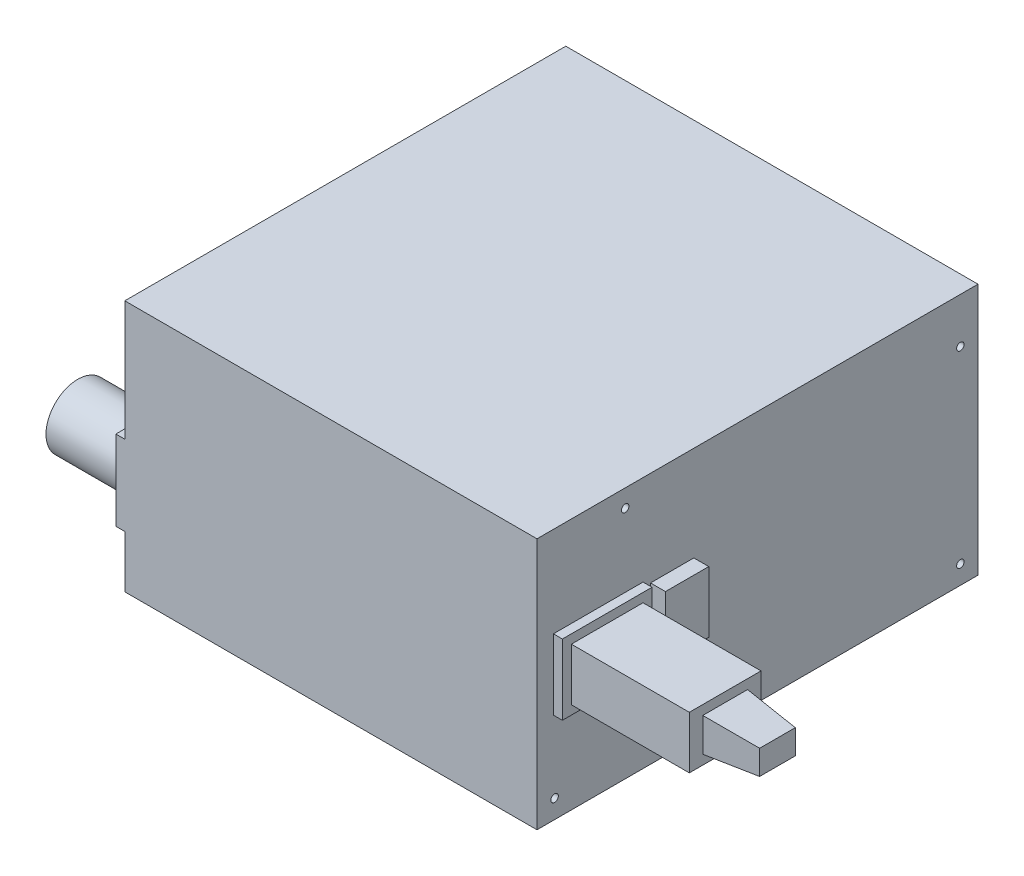
from build123d import *

# Parameters (mm, degrees)
SKETCH1_W           = 140.208
SKETCH1_H           = 150
BOSS_EXTRUDE1_DEPTH = 85.725
SKETCH2_W           = 30.48
SKETCH2_H           = 23.9522
SKETCH2_W_2         = 24.384
SKETCH2_H_2         = 17.8562
BOSS_EXTRUDE2_DEPTH = 3.048
SKETCH3_W           = 14.732
SKETCH3_H           = 20.828
BOSS_EXTRUDE3_DEPTH = 5.08
SKETCH4_R           = 1.27
CUT_EXTRUDE1_DEPTH  = 3.81
BOSS_EXTRUDE4_DEPTH = 3.048
SKETCH6_R           = 10.795
BOSS_EXTRUDE5_DEPTH = 25.4
SKETCH7_W           = 24.384
SKETCH7_H           = 17.8562
BOSS_EXTRUDE6_DEPTH = 43.18
SKETCH8_W           = 15.24
SKETCH8_H           = 11.43
BOSS_EXTRUDE7_DEPTH = 17.78
BOSS_EXTRUDE7_TAPER = 5


with BuildPart() as part:
    # Sketch1 → Boss-Extrude1 (new body)
    with BuildSketch(Plane(origin=(0, 0, 0), x_dir=(1, 0, 0), z_dir=(0, 1, 0))):
        with Locations((-120.400582929, 25.928824242)):
            Rectangle(SKETCH1_W, SKETCH1_H)
    extrude(amount=BOSS_EXTRUDE1_DEPTH)

    # Sketch2 → Boss-Extrude2 (add)
    with BuildSketch(Plane(origin=(-50.296582929, 0, 0), x_dir=(0, 0, -1), z_dir=(1, 0, 0))):
        with Locations((-28.243175758, 42.9641)):
            Rectangle(SKETCH2_W, SKETCH2_H)
        with Locations((-28.243175758, 42.9641)):
            Rectangle(SKETCH2_W_2, SKETCH2_H_2, mode=Mode.SUBTRACT)
    extrude(amount=BOSS_EXTRUDE2_DEPTH)

    # Sketch3 → Boss-Extrude3 (add)
    with BuildSketch(Plane(origin=(-50.296582929, 0, 0), x_dir=(0, 0, -1), z_dir=(1, 0, 0))):
        with Locations((-3.097175758, 43.0022)):
            Rectangle(SKETCH3_W, SKETCH3_H)
    extrude(amount=BOSS_EXTRUDE3_DEPTH)

    # Sketch4 → Cut-Extrude1 (cut)
    with BuildSketch(Plane(origin=(-50.296582929, 0, 0), x_dir=(0, 0, -1), z_dir=(1, 0, 0))):
        with Locations((-43.071175758, 6.35)):
            Circle(SKETCH4_R)
        with Locations((94.928824242, 6.35)):
            Circle(SKETCH4_R)
        with Locations((94.928824242, 70.35)):
            Circle(SKETCH4_R)
        with Locations((-19.071175758, 79.725)):
            Circle(SKETCH4_R)
    extrude(amount=-CUT_EXTRUDE1_DEPTH, mode=Mode.SUBTRACT)

    # Sketch5 → Boss-Extrude4 (add)
    with BuildSketch(Plane.ZY.offset(190.504582929)):
        with BuildLine():
            Line((49.071175758, 17.78), (26.211175758, 17.78))
            ThreePointArc((26.211175758, 17.78), (12.622175758, 31.369), (26.211175758, 44.958))
            Line((26.211175758, 44.958), (49.071175758, 44.958))
            Line((49.071175758, 44.958), (49.071175758, 17.78))
        make_face()
    extrude(amount=BOSS_EXTRUDE4_DEPTH)

    # Sketch6 → Boss-Extrude5 (add)
    with BuildSketch(Plane.ZY.offset(193.552582929)):
        with Locations((36.622716845, 31.369)):
            Circle(SKETCH6_R)
    extrude(amount=BOSS_EXTRUDE5_DEPTH)

    # Sketch7 → Boss-Extrude6 (add)
    with BuildSketch(Plane(origin=(-50.296582929, 0, 0), x_dir=(0, 0, -1), z_dir=(1, 0, 0))):
        with Locations((-28.243175758, 42.9641)):
            Rectangle(SKETCH7_W, SKETCH7_H)
    extrude(amount=BOSS_EXTRUDE6_DEPTH)

    # Sketch8 → Boss-Extrude7 (add)
    with BuildSketch(Plane(origin=(-7.116582929, 0, 0), x_dir=(0, 0, -1), z_dir=(1, 0, 0))):
        with Locations((-28.243175758, 42.9641)):
            Rectangle(SKETCH8_W, SKETCH8_H)
    extrude(amount=BOSS_EXTRUDE7_DEPTH, taper=BOSS_EXTRUDE7_TAPER)


solid = part.part
